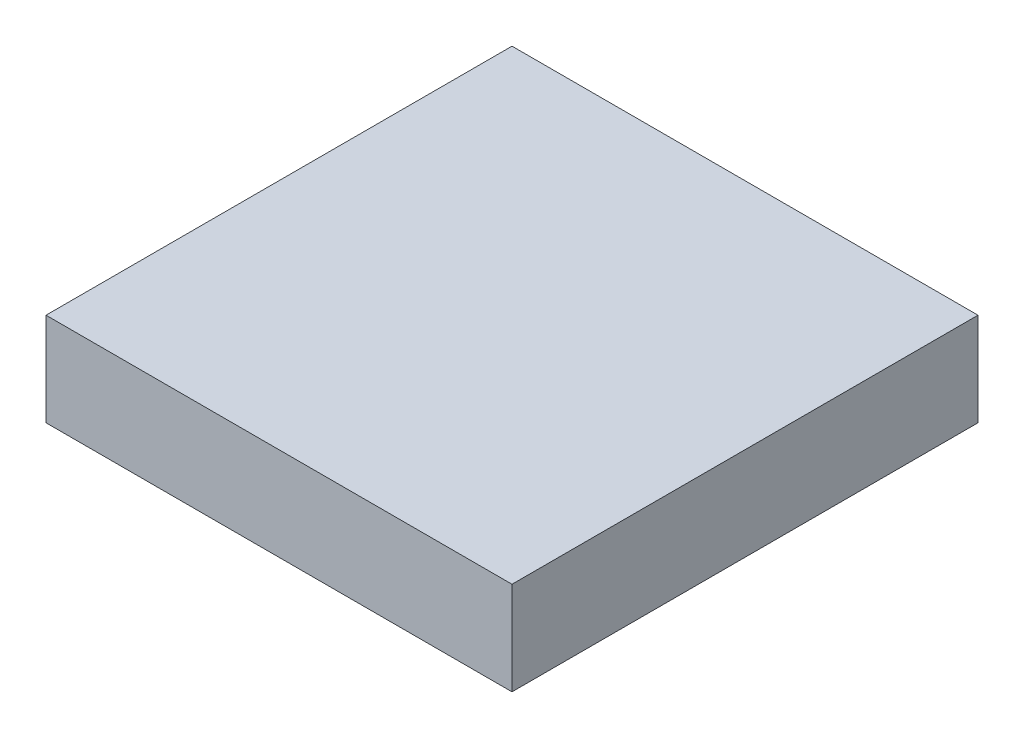
from build123d import *

# Parameters (mm, degrees)
SKETCH_1_W      = 20
SKETCH_1_H      = 20
EXTRUDE_1_DEPTH = 4


with BuildPart() as part:
    # 스케치1 → 보스-돌출1 (new body)
    with BuildSketch(Plane(origin=(0, 0, 0), x_dir=(1, 0, 0), z_dir=(0, 1, 0))):
        Rectangle(SKETCH_1_W, SKETCH_1_H)
    extrude(amount=EXTRUDE_1_DEPTH)


solid = part.part
